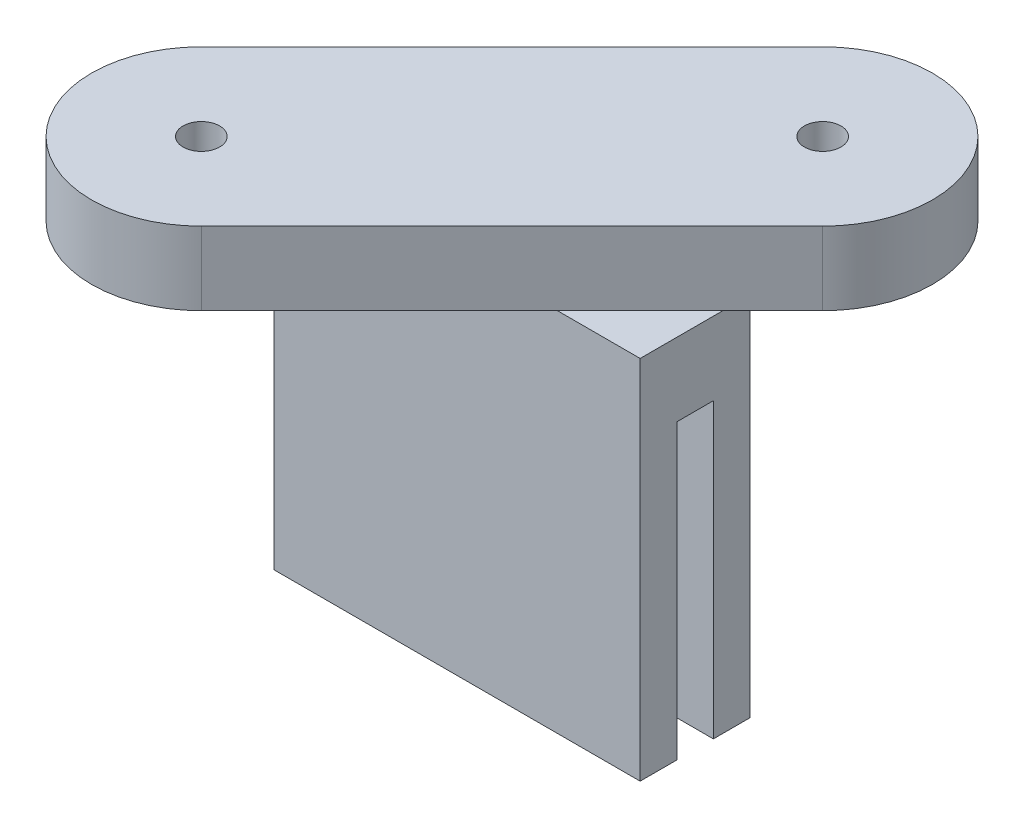
from build123d import *

# Parameters (mm, degrees)
CROQUIS1_R              = 5
SALIENTE_EXTRUIR1_DEPTH = 20
CROQUIS2_W              = 100
CROQUIS2_H              = 30
SALIENTE_EXTRUIR2_DEPTH = 100
CROQUIS3_W              = 100
CROQUIS3_H              = 10
CORTAR_EXTRUIR1_DEPTH   = 80


with BuildPart() as part:
    # Croquis1 → Saliente-Extruir1 (new body)
    with BuildSketch(Plane(origin=(0, 0, 0), x_dir=(1, 0, 0), z_dir=(0, 1, 0))):
        with BuildLine():
            Line((63.639610307, 21.213203436), (-21.213203436, -63.639610307))
            ThreePointArc((-21.213203436, -63.639610307), (-63.639610307, -63.639610307), (-63.639610307, -21.213203436))
            Line((-63.639610307, -21.213203436), (21.213203436, 63.639610307))
            ThreePointArc((21.213203436, 63.639610307), (63.639610307, 63.639610307), (63.639610307, 21.213203436))
        make_face()
        with Locations(Location((-42.426406871, -42.426406871, 0), (0, 0, 270))):
            Circle(CROQUIS1_R, mode=Mode.SUBTRACT)
        with Locations(Location((42.426406871, 42.426406871, 0), (0, 0, 90))):
            Circle(CROQUIS1_R, mode=Mode.SUBTRACT)
    extrude(amount=SALIENTE_EXTRUIR1_DEPTH)

    # Croquis2 → Saliente-Extruir2 (add)
    with BuildSketch(Plane.XZ):
        Rectangle(CROQUIS2_W, CROQUIS2_H)
    extrude(amount=SALIENTE_EXTRUIR2_DEPTH)

    # Croquis3 → Cortar-Extruir1 (cut)
    with BuildSketch(Plane.XZ.offset(100)):
        Rectangle(CROQUIS3_W, CROQUIS3_H)
    extrude(amount=-CORTAR_EXTRUIR1_DEPTH, mode=Mode.SUBTRACT)


solid = part.part
